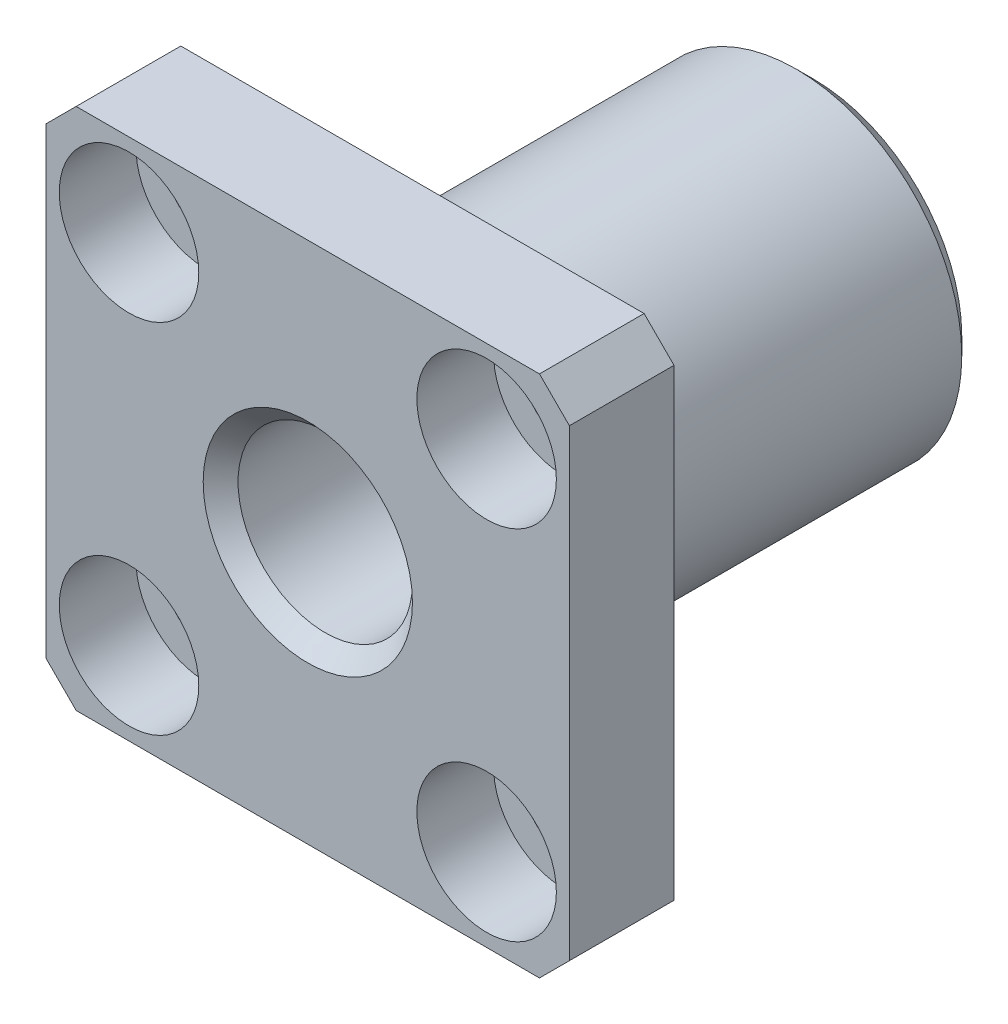
from build123d import *

# Parameters (mm, degrees)
SKETCH1_R                                           = 9.5
BOSS_EXTRUDE1_DEPTH                                 = 29
SKETCH2_W                                           = 30
SKETCH2_H                                           = 30
BOSS_EXTRUDE2_DEPTH                                 = 6
CUT_EXTRUDE1_DEPTH                                  = 36.930488446
CBORE_FOR_M4_HEX_SOCKET_HEAD_CAP_SCREW1_D           = 4.5
CBORE_FOR_M4_HEX_SOCKET_HEAD_CAP_SCREW1_DEPTH       = 22
CBORE_FOR_M4_HEX_SOCKET_HEAD_CAP_SCREW1_CBORE_D     = 8
CBORE_FOR_M4_HEX_SOCKET_HEAD_CAP_SCREW1_CBORE_DEPTH = 4.4
CBORE_FOR_M4_HEX_SOCKET_HEAD_CAP_SCREW1_TIP         = 1.351936393
SKETCH8_R                                           = 5
CUT_EXTRUDE2_DEPTH                                  = 36.930488446
CHAMFER1_SIZE                                       = 1


with BuildPart() as part:
    # Sketch1 → Boss-Extrude1 (new body)
    with BuildSketch(Plane.XY):
        with Locations(Location((0, 0, 0), (0, 0, 180))):
            Circle(SKETCH1_R)
    extrude(amount=BOSS_EXTRUDE1_DEPTH)

    # Sketch2 → Boss-Extrude2 (add)
    with BuildSketch(Plane.XY.offset(29)):
        Rectangle(SKETCH2_W, SKETCH2_H)
    extrude(amount=-BOSS_EXTRUDE2_DEPTH)

    # Sketch4 → Cut-Extrude1 (cut, through all)
    with BuildSketch(Plane.XY.offset(29)):
        Polygon((-15, 15), (-15, 13.284271247), (-13.284271247, 15), align=None)
        Polygon((13.284271247, 15), (15, 15), (15, 13.284271247), align=None)
        Polygon((15, -15), (15, -13.284271247), (13.284271247, -15), align=None)
        Polygon((-13.284271247, -15), (-15, -15), (-15, -13.284271247), align=None)
    extrude(amount=-CUT_EXTRUDE1_DEPTH, mode=Mode.SUBTRACT)

    # CBORE for M4 Hex Socket Head Cap Screw1
    with Locations(Plane.XY.offset(29)):
        with Locations((-10.253048327, 10.253048327), (10.253048327, 10.253048327), (10.253048327, -10.253048327), (-10.253048327, -10.253048327)):
            CounterBoreHole(CBORE_FOR_M4_HEX_SOCKET_HEAD_CAP_SCREW1_D / 2, CBORE_FOR_M4_HEX_SOCKET_HEAD_CAP_SCREW1_CBORE_D / 2, CBORE_FOR_M4_HEX_SOCKET_HEAD_CAP_SCREW1_CBORE_DEPTH, depth=CBORE_FOR_M4_HEX_SOCKET_HEAD_CAP_SCREW1_DEPTH)
            with Locations((0, 0, -(CBORE_FOR_M4_HEX_SOCKET_HEAD_CAP_SCREW1_DEPTH + CBORE_FOR_M4_HEX_SOCKET_HEAD_CAP_SCREW1_TIP / 2))):  # 118° drill point
                Cone(0, CBORE_FOR_M4_HEX_SOCKET_HEAD_CAP_SCREW1_D / 2, CBORE_FOR_M4_HEX_SOCKET_HEAD_CAP_SCREW1_TIP, mode=Mode.SUBTRACT)

    # Sketch8 → Cut-Extrude2 (cut, through all)
    with BuildSketch(Plane.XY.offset(29)):
        Circle(SKETCH8_R)
    extrude(amount=-CUT_EXTRUDE2_DEPTH, mode=Mode.SUBTRACT)

    # Chamfer1
    chamfer1_edges = [part.edges().sort_by_distance(p)[0] for p in [
        (-5, 0, 29),
        (9.5, 0, 0),
    ]]
    chamfer(chamfer1_edges, length=CHAMFER1_SIZE)


solid = part.part
